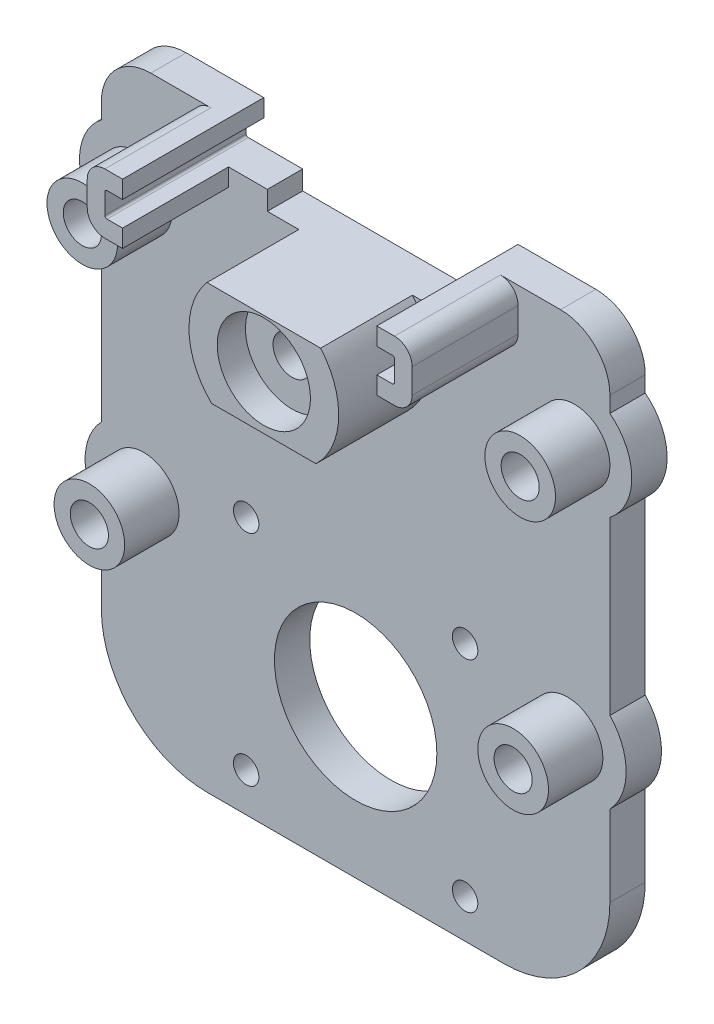
from build123d import *

# Parameters (mm, degrees)
SKETCH_1_R      = 2.7
SKETCH_1_R_2    = 6.6
SKETCH_1_R_3    = 1.8
SKETCH_1_R_4    = 11.5
EXTRUDE_1_DEPTH = 5
EXTRUDE_START   = 4
EXTRUDE_3_DEPTH = 16
FILLET_1_R      = 2.5
FILLET_2_R      = 0.3
SKETCH_9_R      = 5
SKETCH_9_R_2    = 2.7
EXTRUDE_4_DEPTH = 7.7
SKETCH_1_5_R    = 6.6
SKETCH_1_5_R_2  = 2.7
EXTRUDE_5_DEPTH = 10
EXTRUDE_START_2 = 14
SKETCH_1_6_R    = 6.6
EXTRUDE_6_DEPTH = 4


with BuildPart() as part:
    # 草图1 → 凸台-拉伸1 (new body)
    with BuildSketch(Plane.XY):
        with BuildLine():
            ThreePointArc((-29, 43.7), (-33.949747468, 41.649747468), (-36, 36.7))
            Line((-36, 36.7), (-36, 34.472597587))
            ThreePointArc((-36, 34.472597587), (-39.1, 28.1), (-36, 21.727402413))
            Line((-36, 21.727402413), (-36, -2.565019616))
            ThreePointArc((-36, -2.565019616), (-38.3, -8.3), (-36, -14.034980384))
            Line((-36, -14.034980384), (-36, -25.5))
            ThreePointArc((-36, -25.5), (-31.606601718, -36.106601718), (-21, -40.5))
            Line((-21, -40.5), (21, -40.5))
            ThreePointArc((21, -40.5), (31.606601718, -36.106601718), (36, -25.5))
            Line((36, -25.5), (36, -14.034980384))
            ThreePointArc((36, -14.034980384), (38.3, -8.3), (36, -2.565019616))
            Line((36, -2.565019616), (36, 21.727402413))
            ThreePointArc((36, 21.727402413), (39.1, 28.1), (36, 34.472597587))
            Line((36, 34.472597587), (36, 36.7))
            ThreePointArc((36, 36.7), (33.949747468, 41.649747468), (29, 43.7))
            Line((29, 43.7), (18, 43.7))
            Line((18, 43.7), (18, 41.2))
            Line((18, 41.2), (20.5, 41.2))
            Line((20.5, 41.2), (20.5, 37.7))
            Line((20.5, 37.7), (12.5, 37.7))
            Line((12.5, 37.7), (12.5, 35))
            Line((12.5, 35), (-12.5, 35))
            Line((-12.5, 35), (-12.5, 37.7))
            Line((-12.5, 37.7), (-20.5, 37.7))
            Line((-20.5, 37.7), (-20.5, 41.2))
            Line((-20.5, 41.2), (-18, 41.2))
            Line((-18, 41.2), (-18, 43.7))
            Line((-18, 43.7), (-29, 43.7))
        make_face()
        with Locations((-31, 28.1)):
            Circle(SKETCH_1_R, mode=Mode.SUBTRACT)
        with Locations((-30, -8.3)):
            Circle(SKETCH_1_R, mode=Mode.SUBTRACT)
        with Locations((0, 28.1)):
            Circle(SKETCH_1_R_2, mode=Mode.SUBTRACT)
        with Locations((15.5, -4)):
            Circle(SKETCH_1_R_3, mode=Mode.SUBTRACT)
        with Locations((0, -19.5)):
            Circle(SKETCH_1_R_4, mode=Mode.SUBTRACT)
        with Locations((15.5, -35)):
            Circle(SKETCH_1_R_3, mode=Mode.SUBTRACT)
        with Locations((-15.5, -35)):
            Circle(SKETCH_1_R_3, mode=Mode.SUBTRACT)
        with Locations((-15.5, -4)):
            Circle(SKETCH_1_R_3, mode=Mode.SUBTRACT)
        with Locations((30, -8.3)):
            Circle(SKETCH_1_R, mode=Mode.SUBTRACT)
        with Locations((31, 28.1)):
            Circle(SKETCH_1_R, mode=Mode.SUBTRACT)
    extrude(amount=EXTRUDE_1_DEPTH)

    # 草图1<4> → 凸台-拉伸3 (add)
    with BuildSketch(Plane.XY.offset(EXTRUDE_START)):
        Polygon((-18, 43.7), (-23, 43.7), (-23, 35.2), (-18, 35.2), (-18, 37.7), (-20.5, 37.7), (-20.5, 41.2), (-18, 41.2), align=None)
        Polygon((20.5, 37.7), (18, 37.7), (18, 35.2), (23, 35.2), (23, 43.7), (18, 43.7), (18, 41.2), (20.5, 41.2), align=None)
    extrude(amount=EXTRUDE_3_DEPTH)

    # 圆角1
    fillet_1_edges = [part.edges().sort_by_distance(p)[0] for p in [
        (-23, 35.2, 12.5),
        (-23, 43.7, 12.5),
        (23, 35.2, 12.5),
        (23, 43.7, 12.5),
    ]]
    fillet(fillet_1_edges, radius=FILLET_1_R)

    # 圆角2
    fillet_2_edges = [part.edges().sort_by_distance(p)[0] for p in [
        (20.5, 37.7, 10),
        (20.5, 41.2, 10),
        (-20.5, 41.2, 10),
        (-20.5, 37.7, 10),
    ]]
    fillet(fillet_2_edges, radius=FILLET_2_R)

    # 草图9 → 凸台-拉伸4 (add)
    # profile 1 of 4: a face of its own
    with BuildSketch(Plane.XY.offset(5)):
        with Locations(Location((-31, 28.1, 0), (0, 0, 180))):
            Circle(SKETCH_9_R)
        with Locations((-31, 28.1)):
            Circle(SKETCH_9_R_2, mode=Mode.SUBTRACT)
    # profile 2 of 4: a face of its own
    with BuildSketch(Plane.XY.offset(5)):
        with Locations(Location((-30, -8.3, 0), (0, 0, 180))):
            Circle(SKETCH_9_R)
        with Locations((-30, -8.3)):
            Circle(SKETCH_9_R_2, mode=Mode.SUBTRACT)
    # profile 3 of 4: a face of its own
    with BuildSketch(Plane.XY.offset(5)):
        with Locations(Location((30, -8.3, 0), (0, 0, 180))):
            Circle(SKETCH_9_R)
        with Locations(Location((30, -8.3, 0), (0, 0, 180))):
            Circle(SKETCH_9_R_2, mode=Mode.SUBTRACT)
    # profile 4 of 4: a face of its own
    with BuildSketch(Plane.XY.offset(5)):
        with Locations(Location((31, 28.1, 0), (0, 0, 180))):
            Circle(SKETCH_9_R)
        with Locations(Location((31, 28.1, 0), (0, 0, 180))):
            Circle(SKETCH_9_R_2, mode=Mode.SUBTRACT)
    extrude(amount=EXTRUDE_4_DEPTH)

    # 草图1<5> → 凸台-拉伸5 (add)
    # profile 1 of 2: a face of its own
    with BuildSketch(Plane.XY.offset(EXTRUDE_START)):
        with BuildLine():
            Line((8.04673847, 35), (-8.04673847, 35))
            ThreePointArc((-8.04673847, 35), (-10.589117274, 27.619796539), (-7.389181281, 20.5))
            Line((-7.389181281, 20.5), (7.389181281, 20.5))
            ThreePointArc((7.389181281, 20.5), (10.589117274, 27.619796539), (8.04673847, 35))
        make_face()
        with Locations((0, 28.1)):
            Circle(SKETCH_1_5_R, mode=Mode.SUBTRACT)
    # profile 2 of 2: a face of its own
    with BuildSketch(Plane.XY.offset(EXTRUDE_START)):
        with Locations((0, 28.1)):
            Circle(SKETCH_1_5_R)
        with Locations((0, 28.1)):
            Circle(SKETCH_1_5_R_2, mode=Mode.SUBTRACT)
    extrude(amount=EXTRUDE_5_DEPTH)

    # 草图1<6> → 凸台-拉伸6 (add)
    with BuildSketch(Plane.XY.offset(EXTRUDE_START_2)):
        with BuildLine():
            Line((8.04673847, 35), (-8.04673847, 35))
            ThreePointArc((-8.04673847, 35), (-10.589117274, 27.619796539), (-7.389181281, 20.5))
            Line((-7.389181281, 20.5), (7.389181281, 20.5))
            ThreePointArc((7.389181281, 20.5), (10.589117274, 27.619796539), (8.04673847, 35))
        make_face()
        with Locations((0, 28.1)):
            Circle(SKETCH_1_6_R, mode=Mode.SUBTRACT)
    extrude(amount=EXTRUDE_6_DEPTH)


solid = part.part
